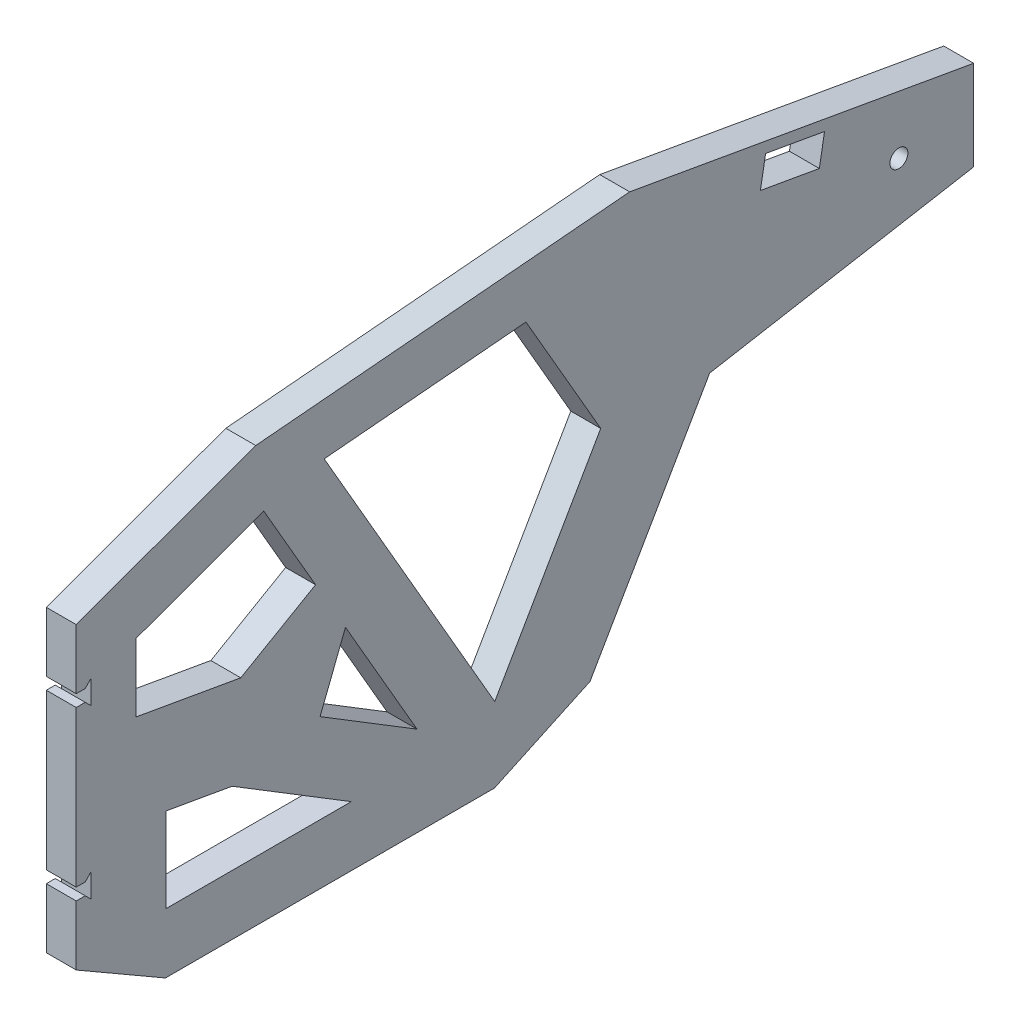
from build123d import *

# Parameters (mm, degrees)
ESQUISSE1_W                  = 300
ESQUISSE1_H                  = 150
BOSS_EXTRU_1_DEPTH           = 5
ESQUISSE2_OUTSIDE_W          = 369.112
ESQUISSE2_OUTSIDE_H          = 219.112
ENL_V_MAT_EXTRU_1_DEPTH      = 5
ENL_V_MAT_EXTRU_2_DEPTH      = 336.559234711
ENL_V_MAT_EXTRU_2_DEPTH_BACK = 336.559234711
ENL_V_MAT_EXTRU_3_DEPTH      = 336.559234711
ENL_V_MAT_EXTRU_3_DEPTH_BACK = 336.559234711
ENL_V_MAT_EXTRU_4_DEPTH      = 336.559234711
ENL_V_MAT_EXTRU_4_DEPTH_BACK = 336.559234711
ESQUISSE5_R                  = 3
ENL_V_MAT_EXTRU_5_DEPTH      = 49


with BuildPart() as part:
    # Esquisse1 → Boss.-Extru.1 (new, symmetric)
    with BuildSketch(Plane(origin=(0, 0, 0), x_dir=(0, 0, -1), z_dir=(1, 0, 0))):
        with Locations((150, 75)):
            Rectangle(ESQUISSE1_W, ESQUISSE1_H)
    extrude(amount=BOSS_EXTRU_1_DEPTH, both=True)

    # Esquisse2 outside → Enlèv. mat.-Extru.1 (cut, symmetric)
    with BuildSketch(Plane(origin=(0, 0, 0), x_dir=(0, 0, -1), z_dir=(1, 0, 0))):
        with Locations((150, 75)):
            Rectangle(ESQUISSE2_OUTSIDE_W, ESQUISSE2_OUTSIDE_H)
        Polygon((0, 117.225703003), (60, 139.063917059), (185, 150), (300, 129.722397219), (300, 99.722397219), (211.741963761, 84.160124165), (171.741963761, 14.878091862), (139.835792798, 0), (29.835792798, 0), (0, 17.225703003), align=None, mode=Mode.SUBTRACT)
    extrude(amount=ENL_V_MAT_EXTRU_1_DEPTH, both=True, mode=Mode.SUBTRACT)

    # Esquisse3 → Enlèv. mat.-Extru.2 (cut, two sides: drawn at the far end of the back side and taken through both)
    with BuildSketch(Plane(origin=(5, 0, 0), x_dir=(0, 0, -1), z_dir=(1, 0, 0)).offset(-ENL_V_MAT_EXTRU_2_DEPTH_BACK)):
        Polygon((20, 103.221552239), (20, 80.493304508), (55, 74.321860183), (80, 88.755616913), (62.679491924, 118.755616913), align=None)
        Polygon((90, 71.435108837), (113.922571241, 30), (81.508057782, 49.831775443), align=None)
        Polygon((82.886751346, 123.755616913), (139.903333355, 25), (175.32640016, 86.354551467), (150.32640016, 129.655821657), align=None)
        Polygon((91.944969354, 20), (30, 20), (30, 48.267236345), (52.117107943, 44.367393479), align=None)
    extrude(amount=ENL_V_MAT_EXTRU_2_DEPTH + ENL_V_MAT_EXTRU_2_DEPTH_BACK, mode=Mode.SUBTRACT)

    # Esquisse4 → Enlèv. mat.-Extru.3 (cut, two sides: drawn at the far end of the back side and taken through both)
    with BuildSketch(Plane(origin=(5, 0, 0), x_dir=(0, 0, -1), z_dir=(1, 0, 0)).offset(-ENL_V_MAT_EXTRU_3_DEPTH_BACK)):
        Polygon((0, 97.225703003), (3, 97.225703003), (5, 99.225703003), (5, 91.225703003), (3, 93.225703003), (0, 93.225703003), align=None)
        Polygon((3, 41.225703003), (0, 41.225703003), (0, 37.225703003), (3, 37.225703003), (5, 35.225703003), (5, 43.225703003), align=None)
    extrude(amount=ENL_V_MAT_EXTRU_3_DEPTH + ENL_V_MAT_EXTRU_3_DEPTH_BACK, mode=Mode.SUBTRACT)

    # Esquisse5 → Enlèv. mat.-Extru.4 (cut, two sides: drawn at the far end of the back side and taken through both)
    with BuildSketch(Plane.ZY.offset(5).offset(-ENL_V_MAT_EXTRU_4_DEPTH_BACK)):
        with Locations((-275, 114.722397219)):
            Circle(ESQUISSE5_R)
    extrude(amount=ENL_V_MAT_EXTRU_4_DEPTH + ENL_V_MAT_EXTRU_4_DEPTH_BACK, mode=Mode.SUBTRACT)

    # Esquisse6 → Enlèv. mat.-Extru.5 (cut)
    with BuildSketch(Plane(origin=(5, 0, 0), x_dir=(0, 0, -1), z_dir=(1, 0, 0))):
        Polygon((230.447006258, 138.381702132), (250.143161319, 134.908738579), (248.406679542, 125.060661049), (228.710524482, 128.533624602), align=None)
    extrude(amount=-ENL_V_MAT_EXTRU_5_DEPTH, mode=Mode.SUBTRACT)


solid = part.part
